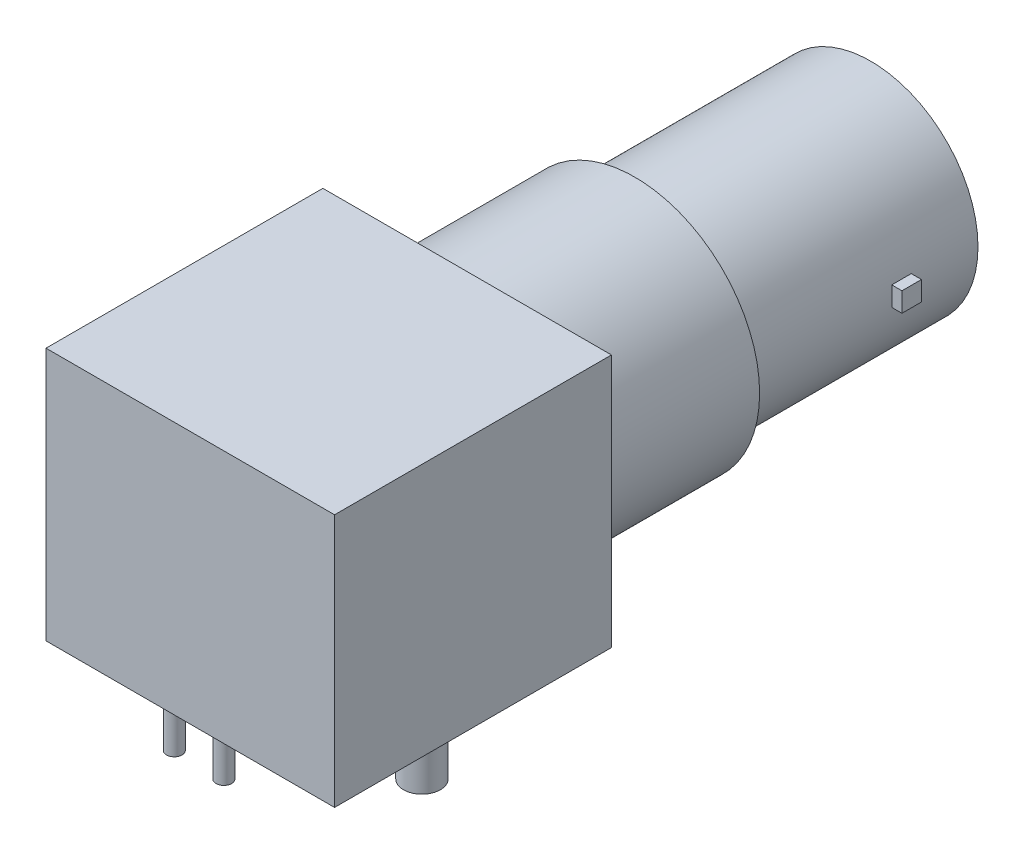
from build123d import *

# Parameters (mm, degrees)
SKETCH_1_W           = 14.8
SKETCH_1_H           = 13
EXTRUDE_1_DEPTH      = 14.2
SKETCH_2_R           = 6.4
EXTRUDE_2_DEPTH      = 8.6
SKETCH_3_R           = 5.5
SKETCH_3_R_2         = 5
EXTRUDE_3_DEPTH      = 12.1
EXTRUDE_4_DEPTH      = 6
EXTRUDE_4_DEPTH_BACK = 6
SKETCH_4_W           = 1
SKETCH_4_H           = 1
SKETCH_7_R           = 0.95
SKETCH_7_R_2         = 0.4
EXTRUDE_5_DEPTH      = 3.3


with BuildPart() as part:
    # Эскиз1 → Бобышка-Вытянуть1 (new body)
    with BuildSketch(Plane.XY):
        Rectangle(SKETCH_1_W, SKETCH_1_H)
    extrude(amount=-EXTRUDE_1_DEPTH)

    # Эскиз2 → Бобышка-Вытянуть2 (add)
    with BuildSketch(Plane(origin=(0, 0, -14.2), x_dir=(-1, 0, 0), z_dir=(0, 0, -1))):
        with Locations(Location((0, 0, 0), (0, 0, 180))):
            Circle(SKETCH_2_R)
    extrude(amount=EXTRUDE_2_DEPTH)

    # Эскиз3 → Бобышка-Вытянуть3 (add)
    with BuildSketch(Plane(origin=(0, 0, -22.8), x_dir=(-1, 0, 0), z_dir=(0, 0, -1))):
        Circle(SKETCH_3_R)
        Circle(SKETCH_3_R_2, mode=Mode.SUBTRACT)
    extrude(amount=EXTRUDE_3_DEPTH)

    # Эскиз4 → Бобышка-Вытянуть4 (add, two sides: drawn at the far end of the back side and taken through both)
    with BuildSketch(Plane(origin=(0, 0, 0), x_dir=(0, 0, -1), z_dir=(1, 0, 0)).offset(-EXTRUDE_4_DEPTH_BACK)):
        with Locations((31, 0)):
            Rectangle(SKETCH_4_W, SKETCH_4_H)
    extrude(amount=EXTRUDE_4_DEPTH + EXTRUDE_4_DEPTH_BACK)

    # Эскиз7 → Бобышка-Вытянуть5 (add)
    with BuildSketch(Plane.XZ.offset(6.5)):
        with Locations(Location((5.08, -6.8, 0), (0, 0, 270))):
            Circle(SKETCH_7_R)
        with Locations(Location((-5.08, -6.8, 0), (0, 0, 270))):
            Circle(SKETCH_7_R)
        with Locations(Location((0, -1.72, 0), (0, 0, 270))):
            Circle(SKETCH_7_R_2)
        with Locations(Location((-2.54, -1.72, 0), (0, 0, 270))):
            Circle(SKETCH_7_R_2)
    extrude(amount=EXTRUDE_5_DEPTH)


solid = part.part
